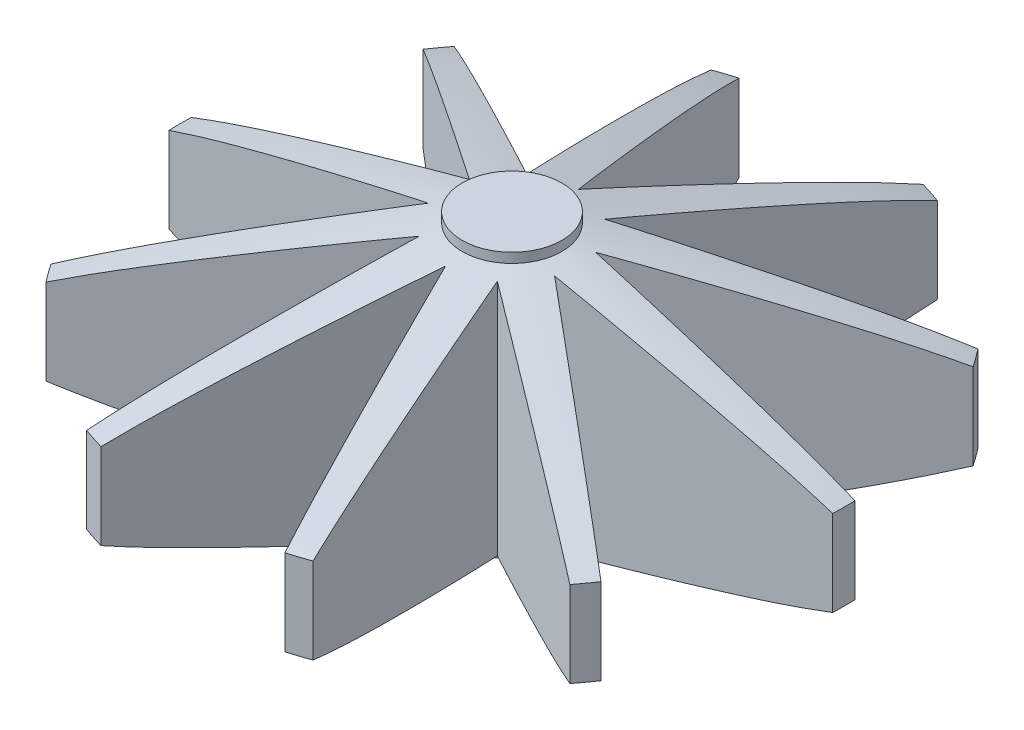
from build123d import *

# Parameters (mm, degrees)
CUT_EXTRUDE1_DEPTH = 132.982271652
CIRPATTERN2_COUNT  = 10


with BuildPart() as part:
    # Sketch2 → Revolve1 (revolve)
    with BuildSketch(Plane.XY):
        with BuildLine():
            Line((0, 0), (9.525, 0))
            Line((9.525, 0), (9.525, 14.553569803))
            add(Edge.make_bspline(
                [(9.525, 61.646430197), (101.6, 38.1), (9.525, 14.553569803)],
                knots=[0, 0, 0, 1, 1, 1], degree=2, weights=[1, 2.625, 1]))
            Line((9.525, 61.646430197), (9.525, 76.2))
            Line((9.525, 76.2), (0, 76.2))
            Line((0, 76.2), (0, 67.481292958))
            Line((0, 67.481292958), (0, 16.681292958))
            Line((0, 16.681292958), (0, 0))
        make_face()
    revolve(axis=Axis((0, 0, 0), (0, 1, 0)))

    # Sketch3 → Cut-Extrude1 (cut, through all)
    with BuildSketch(Plane(origin=(0, 0, 0), x_dir=(1, 0, 0), z_dir=(0, 1, 0))):
        Polygon((-27.734531851, -88.9), (0, -12.7), (27.734531851, -88.9), align=None)
    cut_extrude1 = extrude(amount=CUT_EXTRUDE1_DEPTH, mode=Mode.SUBTRACT)

    # CirPattern2: Cut-Extrude1 ×10 about axis
    cirpattern2_axis = Axis((0, 0, 0), (0, -1, 0))
    for i in range(1, CIRPATTERN2_COUNT):
        add(cut_extrude1.rotate(cirpattern2_axis, i * 360 / CIRPATTERN2_COUNT), mode=Mode.SUBTRACT)


with BuildPart() as body_2:
    # Sketch4 → Revolve2 (revolve)
    with BuildSketch(Plane.XY):
        with BuildLine():
            Line((9.525, 63.5), (50.8, 63.5))
            ThreePointArc((50.8, 63.5), (59.780256121, 59.780256121), (63.5, 50.8))
            Line((63.5, 50.8), (63.5, 25.4))
            ThreePointArc((63.5, 25.4), (59.780256121, 16.419743879), (50.8, 12.7))
            Line((50.8, 12.7), (9.525, 12.7))
            Line((9.525, 12.7), (0, 12.7))
            Line((0, 12.7), (0, 63.5))
            Line((0, 63.5), (9.525, 63.5))
        make_face()
    revolve(axis=Axis((0, 12.7, 0), (0, 1, 0)))


with BuildPart() as part_1:
    add(part.part)

    # Combine2: intersect body 2
    add(body_2.part, mode=Mode.INTERSECT)


solid = part_1.part
